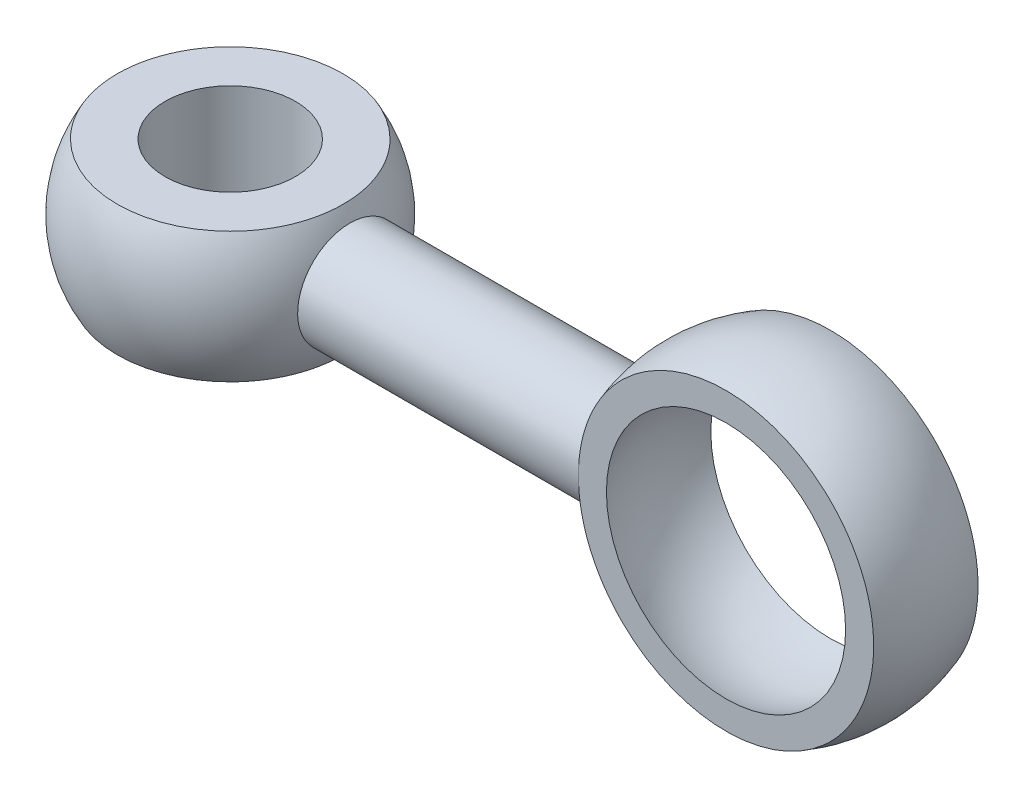
from build123d import *
from build123d.topology import SkipClean

# Parameters (mm, degrees)
CUT_EXTRUDE1_DEPTH      = 5
SKETCH3_R               = 2.5
CUT_EXTRUDE2_DEPTH      = 10
CUT_EXTRUDE4_DEPTH      = 28.349589
CUT_EXTRUDE4_DEPTH_BACK = 28.349589
CUT_EXTRUDE5_REACH      = 29.586
SKETCH5_R               = 4.5


with BuildPart() as part:
    # Sketch1 → Revolve1 (revolve)
    with BuildSketch(Plane.XY, mode=Mode.PRIVATE) as revolve1_sk:
        with BuildLine():
            Line((6, 0), (-26, 0))
            ThreePointArc((-26, 0), (-22.021548, 4.894532), (-16.417424, 2))
            Line((-16.417424, 2), (-5.656854, 2))
            ThreePointArc((-5.656854, 2), (1.014612, 5.913591), (6, 0))
        make_face()
    revolve(revolve1_sk.sketch.rotate(Axis((6.214657, 0, 0), (-1, 0, 0)), 90), axis=Axis((6.214657, 0, 0), (-1, 0, 0)))

    # Sketch2 → Cut-Extrude1 (cut, symmetric)
    with SkipClean():  # the faces are left unmerged after this step: merging them gives an invalid solid
        with BuildSketch(Plane.XY):
            with BuildLine():
                Line((-16.669873, 2.5), (-25.330127, 2.5))
                ThreePointArc((-25.330127, 2.5), (-21, 5), (-16.669873, 2.5))
            make_face()
            with BuildLine():
                Line((-16.669873, -2.5), (-25.330127, -2.5))
                ThreePointArc((-25.330127, -2.5), (-21, -5), (-16.669873, -2.5))
            make_face()
        extrude(amount=CUT_EXTRUDE1_DEPTH, both=True, mode=Mode.SUBTRACT)

    # Sketch3 → Cut-Extrude2 (cut)
    with SkipClean():  # the faces are left unmerged after this step: merging them gives an invalid solid
        with BuildSketch(Plane(origin=(0, 2.5, 0), x_dir=(1, 0, 0), z_dir=(0, 1, 0))):
            with Locations(Location((-21, 0, 0), (0, 0, 270))):
                Circle(SKETCH3_R)
        extrude(amount=-CUT_EXTRUDE2_DEPTH, mode=Mode.SUBTRACT)

    # Sketch4 → Cut-Extrude4 (cut, two sides: drawn at the far end of the back side and taken through both)
    with SkipClean():  # the faces are left unmerged after this step: merging them gives an invalid solid
        with BuildSketch(Plane(origin=(0, 0, 0), x_dir=(1, 0, 0), z_dir=(0, 1, 0)).offset(-CUT_EXTRUDE4_DEPTH_BACK)):
            with BuildLine():
                Line((-5.656854, 2), (5.656854, 2))
                ThreePointArc((5.656854, 2), (0, 6), (-5.656854, 2))
            make_face()
            with BuildLine():
                Line((-5.656854, -2), (5.656854, -2))
                ThreePointArc((5.656854, -2), (0, -6), (-5.656854, -2))
            make_face()
        extrude(amount=CUT_EXTRUDE4_DEPTH + CUT_EXTRUDE4_DEPTH_BACK, mode=Mode.SUBTRACT)

    # Sketch5 → Cut-Extrude5 (cut, up to next)
    with BuildSketch(Plane(origin=(0, 0, -2), x_dir=(-1, 0, 0), z_dir=(0, 0, -1)), mode=Mode.PRIVATE) as cut_extrude5_sk1:
        Circle(SKETCH5_R)
    cut_extrude5_tool1 = extrude(cut_extrude5_sk1.sketch, amount=-CUT_EXTRUDE5_REACH, mode=Mode.PRIVATE) & part.part
    add(cut_extrude5_tool1.solids().sort_by_distance((0, 0, -2))[0], mode=Mode.SUBTRACT)

    # Sketch6 → Cut-Revolve1 (revolve, cut)
    with SkipClean():  # the faces are left unmerged after this step: merging them gives an invalid solid
        with BuildSketch(Plane.XY):
            with BuildLine():
                Line((0, 5), (0, -5))
                ThreePointArc((0, -5), (-5, 0), (0, 5))
            make_face()
        revolve(axis=Axis((0, 8.612845, 0), (0, -1, 0)), mode=Mode.SUBTRACT)


solid = part.part
